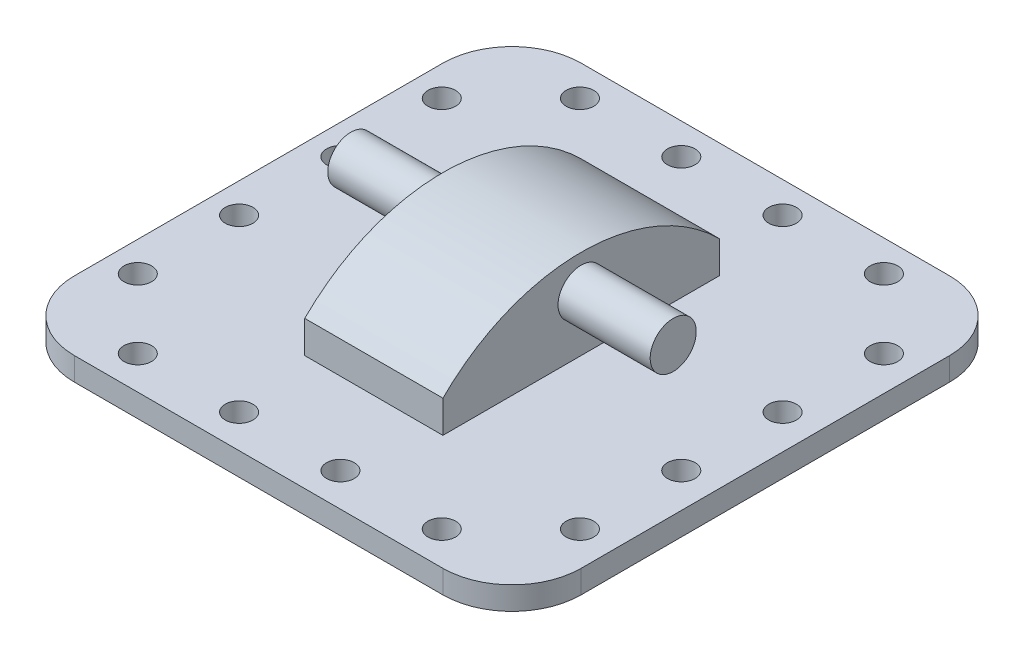
from build123d import *

# Parameters (mm, degrees)
SKETCH1_W                = 110
SKETCH1_H                = 110
BOSS_EXTRUDE1_DEPTH      = 5
FILLET2_R                = 15
FILLET3_R                = 15
FILLET4_R                = 15
FILLET5_R                = 15
SKETCH2_W                = 30
SKETCH2_H                = 60
BOSS_EXTRUDE2_DEPTH      = 24
BOSS_EXTRUDE3_DEPTH      = 20
BOSS_EXTRUDE3_DEPTH_BACK = 50
SKETCH4_R                = 5
FILLET6_R                = 10
FILLET7_R                = 10
SKETCH5_R                = 3
CUT_EXTRUDE2_DEPTH       = 10
CUT_EXTRUDE3_DEPTH       = 60


with BuildPart() as part:
    # Sketch1 → Boss-Extrude1 (new body)
    with BuildSketch(Plane(origin=(0, 0, 0), x_dir=(1, 0, 0), z_dir=(0, 1, 0))):
        Rectangle(SKETCH1_W, SKETCH1_H)
    extrude(amount=BOSS_EXTRUDE1_DEPTH)

    # Fillet2
    fillet2_edges = [part.edges().sort_by_distance(p)[0] for p in [
        (55, 2.5, -55),
    ]]
    fillet(fillet2_edges, radius=FILLET2_R)

    # Fillet3
    fillet3_edges = [part.edges().sort_by_distance(p)[0] for p in [
        (-55, 2.5, -55),
    ]]
    fillet(fillet3_edges, radius=FILLET3_R)

    # Fillet4
    fillet4_edges = [part.edges().sort_by_distance(p)[0] for p in [
        (-55, 2.5, 55),
    ]]
    fillet(fillet4_edges, radius=FILLET4_R)

    # Fillet5
    fillet5_edges = [part.edges().sort_by_distance(p)[0] for p in [
        (55, 2.5, 55),
    ]]
    fillet(fillet5_edges, radius=FILLET5_R)

    # Sketch2 → Boss-Extrude2 (add)
    with BuildSketch(Plane(origin=(0, 5, 0), x_dir=(1, 0, 0), z_dir=(0, 1, 0))):
        Rectangle(SKETCH2_W, SKETCH2_H)
    extrude(amount=BOSS_EXTRUDE2_DEPTH)

    # Sketch4 → Boss-Extrude3 (add, two sides: drawn at the far end of the back side and taken through both)
    with BuildSketch(Plane(origin=(15, 0, 0), x_dir=(0, 0, -1), z_dir=(1, 0, 0)).offset(-BOSS_EXTRUDE3_DEPTH_BACK)):
        with Locations((0, 17)):
            Circle(SKETCH4_R)
    extrude(amount=BOSS_EXTRUDE3_DEPTH + BOSS_EXTRUDE3_DEPTH_BACK)

    # Fillet6
    fillet6_edges = [part.edges().sort_by_distance(p)[0] for p in [
        (0, 29, 30),
    ]]
    fillet(fillet6_edges, radius=FILLET6_R)

    # Fillet7
    fillet7_edges = [part.edges().sort_by_distance(p)[0] for p in [
        (0, 29, -30),
    ]]
    fillet(fillet7_edges, radius=FILLET7_R)

    # Sketch5 → Cut-Extrude2 (cut)
    with BuildSketch(Plane.XZ):
        with Locations(Location((47.497955542, -11.251022229, 0), (0, 0, 270))):
            Circle(SKETCH5_R)
        with Locations(Location((47.497955542, 32.748977771, 0), (0, 0, 270))):
            Circle(SKETCH5_R)
        with Locations(Location((-48.502044458, 10.748977771, 0), (0, 0, 270))):
            Circle(SKETCH5_R)
        with Locations(Location((-48.502044458, -11.251022229, 0), (0, 0, 270))):
            Circle(SKETCH5_R)
        with Locations(Location((-48.502044458, -33.251022229, 0), (0, 0, 270))):
            Circle(SKETCH5_R)
        with Locations(Location((-33.502044458, -48.251022229, 0), (0, 0, 270))):
            Circle(SKETCH5_R)
        with Locations(Location((-11.502044458, -48.251022229, 0), (0, 0, 270))):
            Circle(SKETCH5_R)
        with Locations(Location((10.497955542, -48.251022229, 0), (0, 0, 270))):
            Circle(SKETCH5_R)
        with Locations(Location((32.497955542, -48.251022229, 0), (0, 0, 270))):
            Circle(SKETCH5_R)
        with Locations(Location((47.497955542, -33.251022229, 0), (0, 0, 270))):
            Circle(SKETCH5_R)
        with Locations(Location((47.497955542, 10.748977771, 0), (0, 0, 270))):
            Circle(SKETCH5_R)
        with Locations(Location((32.497955542, 47.748977771, 0), (0, 0, 270))):
            Circle(SKETCH5_R)
        with Locations(Location((10.497955542, 47.748977771, 0), (0, 0, 270))):
            Circle(SKETCH5_R)
        with Locations(Location((-11.502044458, 47.748977771, 0), (0, 0, 270))):
            Circle(SKETCH5_R)
        with Locations(Location((-33.502044458, 47.748977771, 0), (0, 0, 270))):
            Circle(SKETCH5_R)
        with Locations(Location((-48.502044458, 32.748977771, 0), (0, 0, 270))):
            Circle(SKETCH5_R)
    extrude(amount=-CUT_EXTRUDE2_DEPTH, mode=Mode.SUBTRACT)

    # Sketch8 → Cut-Extrude3 (cut)
    with BuildSketch(Plane.ZY.offset(15)):
        with BuildLine():
            Line((-30, 19), (-30, 12))
            ThreePointArc((-30, 12), (0, 24.426406871), (30, 12))
            Line((30, 12), (30, 19))
            ThreePointArc((30, 19), (27.071067812, 26.071067812), (20, 29))
            Line((20, 29), (-20, 29))
            ThreePointArc((-20, 29), (-27.071067812, 26.071067812), (-30, 19))
        make_face()
    extrude(amount=-CUT_EXTRUDE3_DEPTH, mode=Mode.SUBTRACT)


solid = part.part
